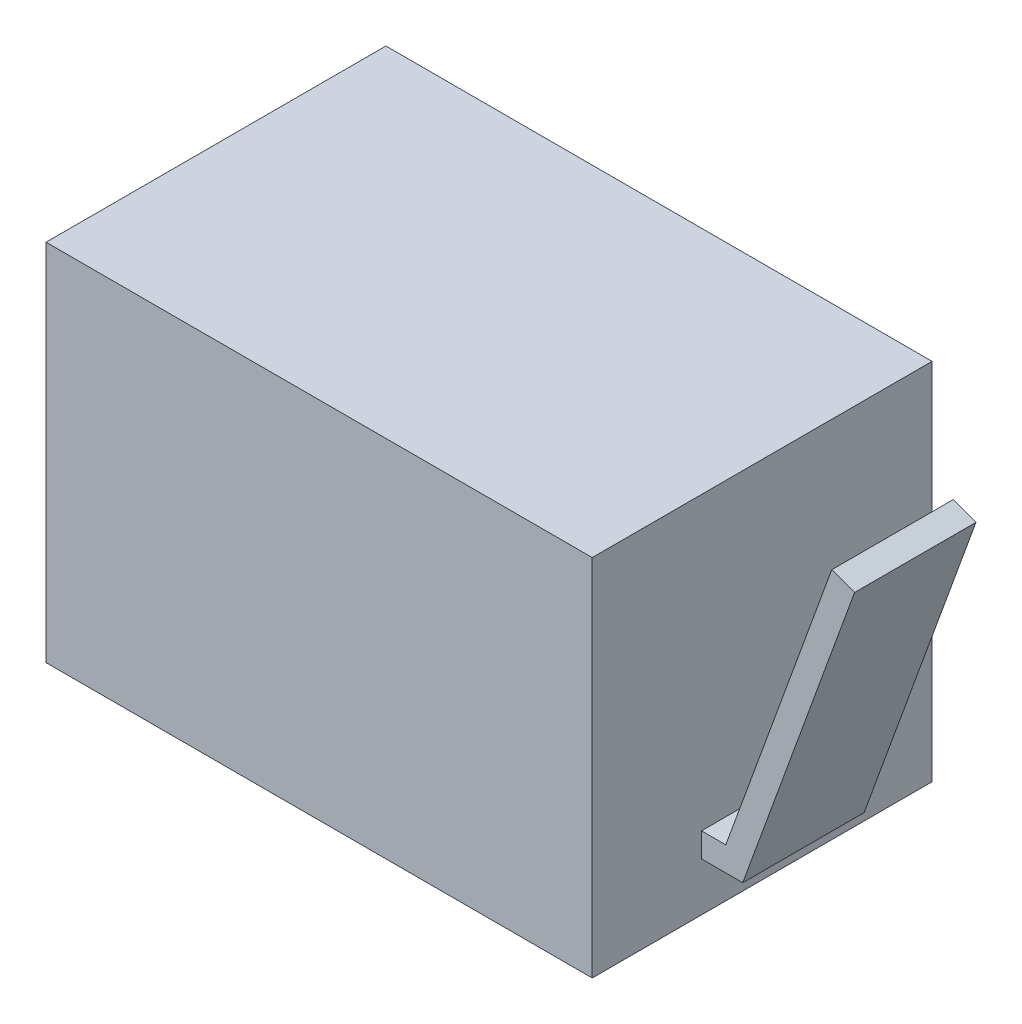
from build123d import *

# Parameters (mm, degrees)
SKETCH1_W                = 45
SKETCH1_H                = 28
BOSS_EXTRUDE1_DEPTH      = 30
BOSS_EXTRUDE2_DEPTH      = 5
BOSS_EXTRUDE2_DEPTH_BACK = 5


with BuildPart() as part:
    # Sketch1 → Boss-Extrude1 (new body)
    with BuildSketch(Plane(origin=(0, 0, 0), x_dir=(1, 0, 0), z_dir=(0, 1, 0))):
        Rectangle(SKETCH1_W, SKETCH1_H)
    extrude(amount=BOSS_EXTRUDE1_DEPTH)

    # Sketch2 → Boss-Extrude2 (add, two sides: drawn at the far end of the back side and taken through both)
    with BuildSketch(Plane.XY.offset(-BOSS_EXTRUDE2_DEPTH_BACK)):
        Polygon((22.5, 4), (25.900415076, 4), (35.114670864, 29.315959713), (33.235285622, 30), (24.5, 6), (22.5, 6), align=None)
    extrude(amount=BOSS_EXTRUDE2_DEPTH + BOSS_EXTRUDE2_DEPTH_BACK)


solid = part.part
